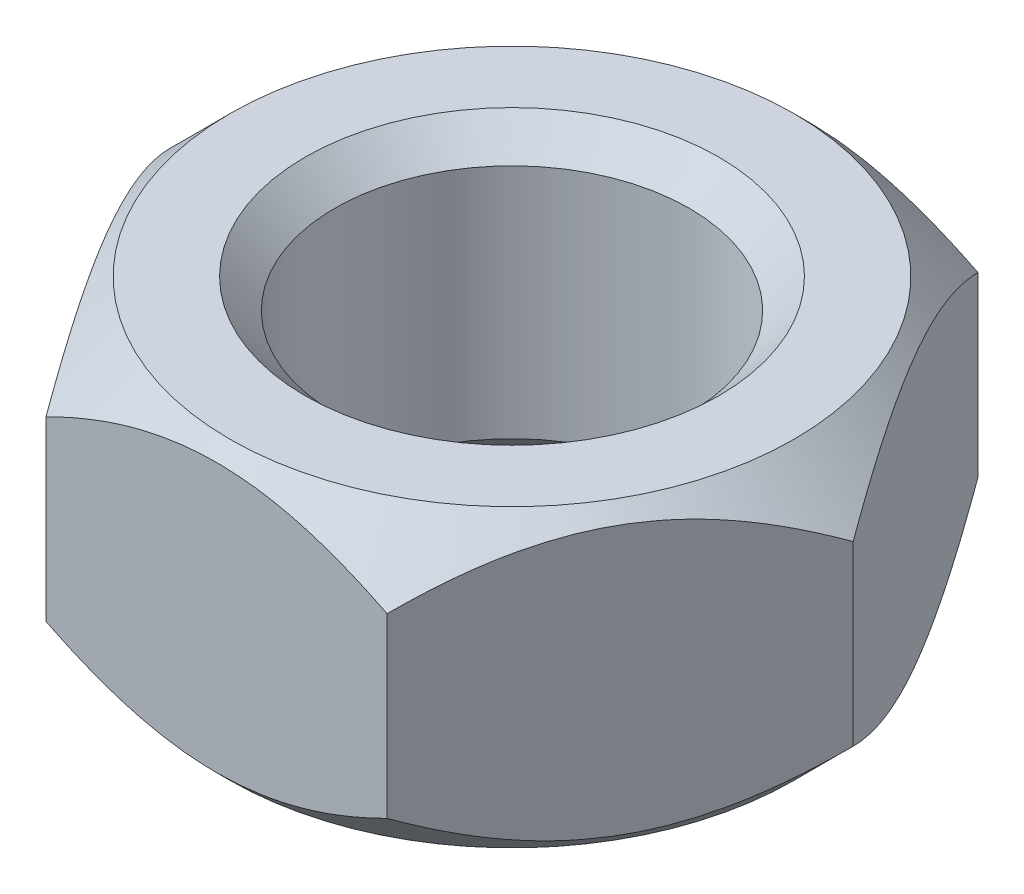
from build123d import *

# Parameters (mm, degrees)
EXTRUDE_1_DEPTH     = 5
SKETCH_2_R          = 3
CUT_EXTRUDE_1_DEPTH = 10.128709292
CHAMFER_1_SIZE      = 0.5


with BuildPart() as part:
    # Эскиз1 → Вытянуть1 (new body)
    with BuildSketch(Plane(origin=(0, 0, 0), x_dir=(1, 0, 0), z_dir=(0, 1, 0))):
        Polygon((-2.886751346, 5), (2.886751346, 5), (5.773502692, 0), (2.886751346, -5), (-2.886751346, -5), (-5.773502692, 0), align=None)
    extrude(amount=-EXTRUDE_1_DEPTH)

    # Эскиз2 → Вырез-Вытянуть1 (cut, through all)
    with BuildSketch(Plane(origin=(0, 0, 0), x_dir=(-1, 0, 0), z_dir=(0, 1, 0))):
        with Locations(Location((0, 0, 0), (0, 0, 90))):
            Circle(SKETCH_2_R)
    extrude(amount=-CUT_EXTRUDE_1_DEPTH, mode=Mode.SUBTRACT)

    # Фаска1
    chamfer_1_edges = [part.edges().sort_by_distance(p)[0] for p in [
        (0, -5, -3),
        (0, 0, -3),
    ]]
    chamfer(chamfer_1_edges, length=CHAMFER_1_SIZE)

    # Эскиз3 → Вырез-Повернуть1 (revolve, cut)
    with BuildSketch(Plane.XY, mode=Mode.PRIVATE) as cut_revolve_1_sk:
        Polygon((-5.773502692, -1), (-4.773502692, 0), (-5.773502692, 0), align=None)
        Polygon((-5.773502692, -4), (-4.773502692, -5), (-5.773502692, -5), align=None)
    revolve(cut_revolve_1_sk.sketch.rotate(Axis((0, -0.5, 0), (0, -1, 0)), 120.000000095), axis=Axis((0, -0.5, 0), (0, -1, 0)), mode=Mode.SUBTRACT)


solid = part.part
